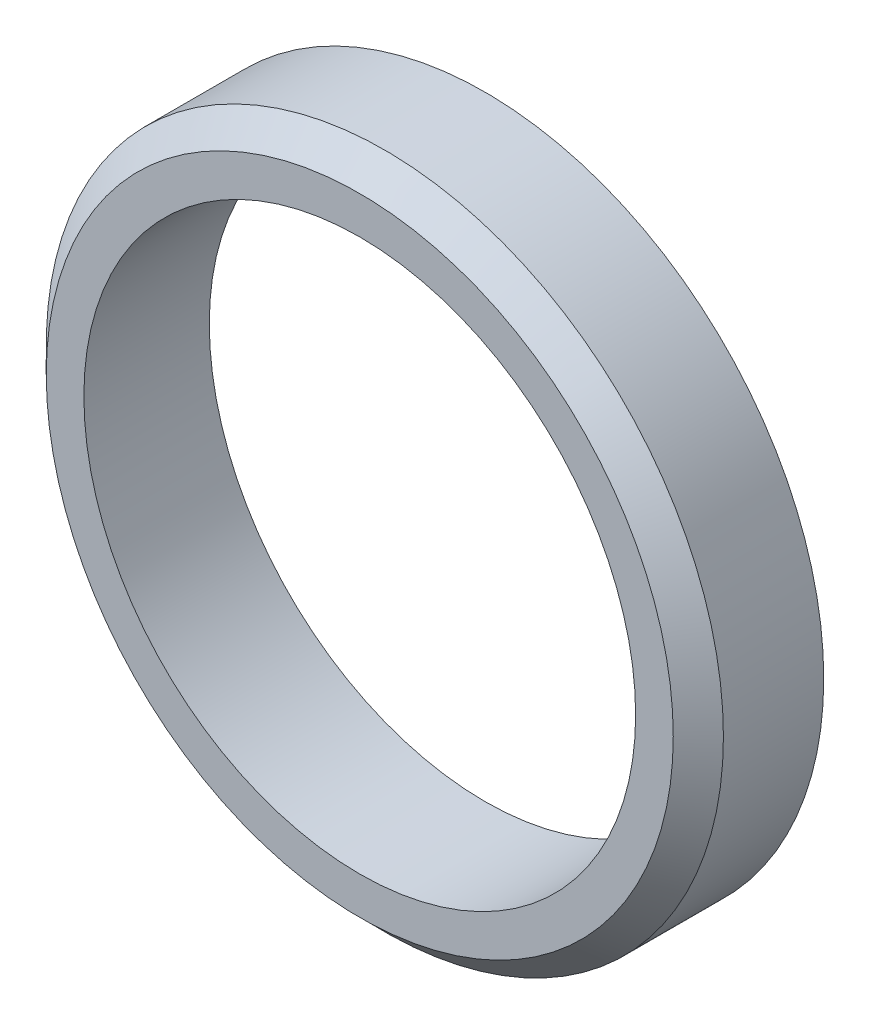
from build123d import *

# Parameters (mm, degrees)
SKETCH_1_R          = 67.5
EXTRUDE_1_DEPTH     = 25
CHAMFER_1_SIZE      = 5
SKETCH_2_R          = 55
CUT_EXTRUDE_1_DEPTH = 99.67877178


with BuildPart() as part:
    # Эскиз1 → Бобышка-Вытянуть1 (new body)
    with BuildSketch(Plane.XY):
        Circle(SKETCH_1_R)
    extrude(amount=EXTRUDE_1_DEPTH)

    # Фаска1
    chamfer_1_edges = [part.edges().sort_by_distance(p)[0] for p in [
        (-67.5, 0, 25),
    ]]
    chamfer(chamfer_1_edges, length=CHAMFER_1_SIZE)

    # Эскиз2 → Вырез-Вытянуть1 (cut, through all)
    with BuildSketch(Plane(origin=(0, 0, 0), x_dir=(-1, 0, 0), z_dir=(0, 0, -1))):
        Circle(SKETCH_2_R)
    extrude(amount=-CUT_EXTRUDE_1_DEPTH, mode=Mode.SUBTRACT)


solid = part.part
